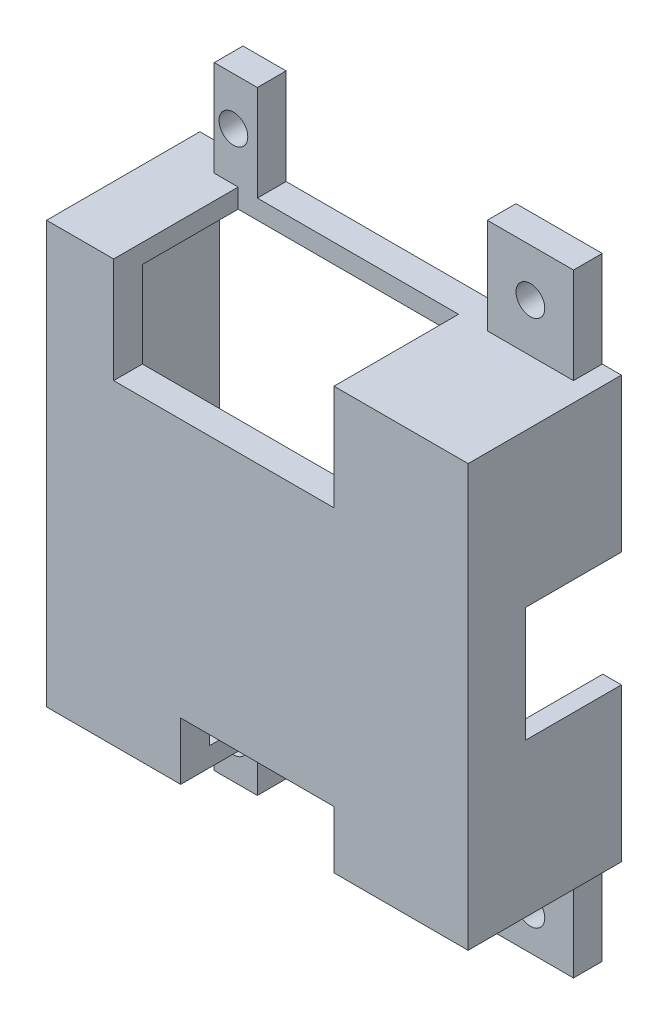
from build123d import *

# Parameters (mm, degrees)
SKETCH1_W           = 44
SKETCH1_H           = 44
BOSS_EXTRUDE1_DEPTH = 16
SKETCH3_W           = 40
SKETCH3_H           = 40
CUT_EXTRUDE1_DEPTH  = 13
SKETCH5_W           = 23
SKETCH5_H           = 11
CUT_EXTRUDE2_DEPTH  = 13
SKETCH6_W           = 16
SKETCH6_H           = 6
CUT_EXTRUDE3_DEPTH  = 10
SKETCH7_W           = 10
SKETCH7_H           = 12
CUT_EXTRUDE4_DEPTH  = 5
SKETCH8_W           = 4.5
SKETCH8_H           = 3
SKETCH8_W_2         = 9
BOSS_EXTRUDE2_DEPTH = 10
SKETCH9_R           = 1.5
CUT_EXTRUDE5_DEPTH  = 10
SKETCH10_W          = 9
SKETCH10_H          = 3
SKETCH10_W_2        = 4.5
BOSS_EXTRUDE3_DEPTH = 10
SKETCH11_R          = 1.5
CUT_EXTRUDE6_DEPTH  = 10


with BuildPart() as part:
    # Sketch1 → Boss-Extrude1 (new body)
    with BuildSketch(Plane.XY):
        with Locations((22, 22)):
            Rectangle(SKETCH1_W, SKETCH1_H)
    extrude(amount=BOSS_EXTRUDE1_DEPTH)

    # Sketch3 → Cut-Extrude1 (cut)
    with BuildSketch(Plane(origin=(0, 0, 0), x_dir=(-1, 0, 0), z_dir=(0, 0, -1))):
        with Locations((-22.063776274, 22)):
            Rectangle(SKETCH3_W, SKETCH3_H)
    extrude(amount=-CUT_EXTRUDE1_DEPTH, mode=Mode.SUBTRACT)

    # Sketch5 → Cut-Extrude2 (cut)
    with BuildSketch(Plane.XY.offset(16)):
        with Locations((18.5, 38.5)):
            Rectangle(SKETCH5_W, SKETCH5_H)
    extrude(amount=-CUT_EXTRUDE2_DEPTH, mode=Mode.SUBTRACT)

    # Sketch6 → Cut-Extrude3 (cut)
    with BuildSketch(Plane.XY.offset(16)):
        with Locations((22, 3)):
            Rectangle(SKETCH6_W, SKETCH6_H)
    extrude(amount=-CUT_EXTRUDE3_DEPTH, mode=Mode.SUBTRACT)

    # Sketch7 → Cut-Extrude4 (cut)
    with BuildSketch(Plane(origin=(44, 0, 0), x_dir=(0, 0, -1), z_dir=(1, 0, 0))):
        with Locations((-5, 22)):
            Rectangle(SKETCH7_W, SKETCH7_H)
    extrude(amount=-CUT_EXTRUDE4_DEPTH, mode=Mode.SUBTRACT)

    # Sketch8 → Boss-Extrude2 (add)
    with BuildSketch(Plane(origin=(0, 0, 0), x_dir=(-1, 0, 0), z_dir=(0, -1, 0))):
        with Locations((-6.75, -1.5)):
            Rectangle(SKETCH8_W, SKETCH8_H)
        with Locations((-37.5, -1.5)):
            Rectangle(SKETCH8_W_2, SKETCH8_H)
    extrude(amount=BOSS_EXTRUDE2_DEPTH)

    # Sketch9 → Cut-Extrude5 (cut)
    with BuildSketch(Plane.XY.offset(3)):
        with Locations((6.5, -6.077320914)):
            Circle(SKETCH9_R)
        with Locations((37.5, -6.077320914)):
            Circle(SKETCH9_R)
    extrude(amount=-CUT_EXTRUDE5_DEPTH, mode=Mode.SUBTRACT)

    # Sketch10 → Boss-Extrude3 (add)
    with BuildSketch(Plane(origin=(0, 44, 0), x_dir=(1, 0, 0), z_dir=(0, 1, 0))):
        with Locations((37.5, -1.5)):
            Rectangle(SKETCH10_W, SKETCH10_H)
        with Locations((6.75, -1.5)):
            Rectangle(SKETCH10_W_2, SKETCH10_H)
    extrude(amount=BOSS_EXTRUDE3_DEPTH)

    # Sketch11 → Cut-Extrude6 (cut)
    with BuildSketch(Plane.XY.offset(3)):
        with Locations((37.5, 49.031327524)):
            Circle(SKETCH11_R)
        with Locations((6.5, 49.031327524)):
            Circle(SKETCH11_R)
    extrude(amount=-CUT_EXTRUDE6_DEPTH, mode=Mode.SUBTRACT)


solid = part.part
